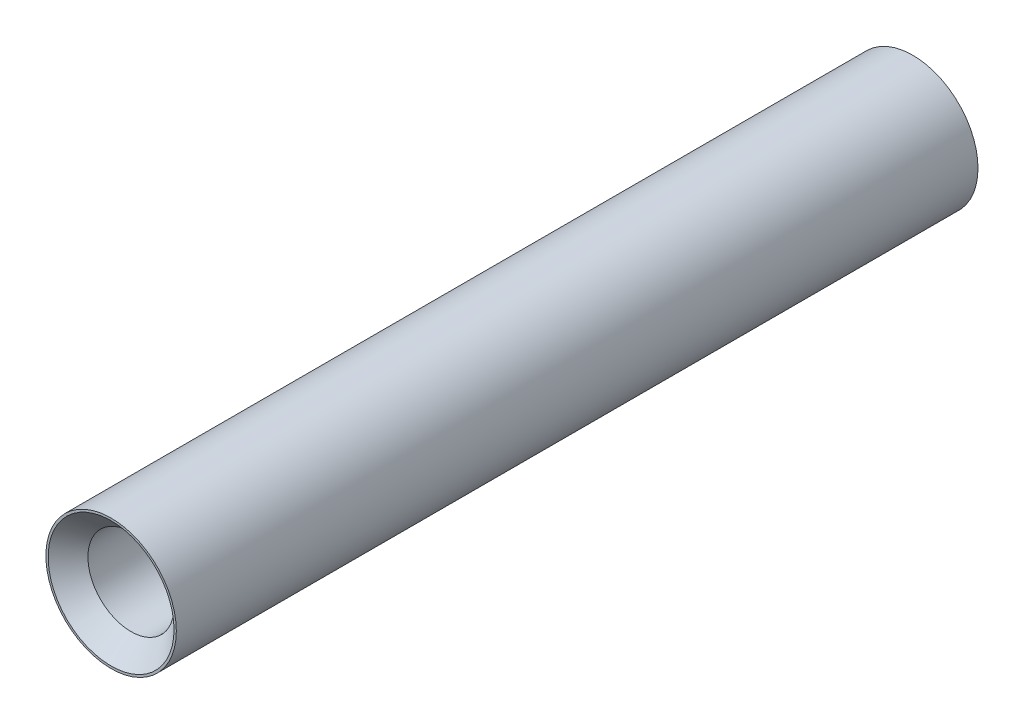
from build123d import *

# Parameters (mm, degrees)
SKETCH1_R           = 3.5
BOSS_EXTRUDE1_DEPTH = 43.02


with BuildPart() as part:
    # Sketch1 → Boss-Extrude1 (new body)
    with BuildSketch(Plane.XY):
        Circle(SKETCH1_R)
    extrude(amount=BOSS_EXTRUDE1_DEPTH)

    # Sketch7 → #12-28 Tapped Hole1 (revolve, cut)
    with BuildSketch(Plane(origin=(0, 0, 43.02), x_dir=(0, -1, 0), z_dir=(1, 0, 0))):
        Polygon((0, 0), (0, 15.078829235), (2.3114, 13.69), (2.3114, 1.0668), (3.3782, 0), align=None)
    f_12_28_tapped_hole1 = revolve(axis=Axis((0, 0, 49.37), (0, 0, -1)), mode=Mode.SUBTRACT)

    # Mirror1: #12-28 Tapped Hole1 across plane
    add(f_12_28_tapped_hole1.mirror(Plane.XY.offset(21.51)), mode=Mode.SUBTRACT)


solid = part.part
